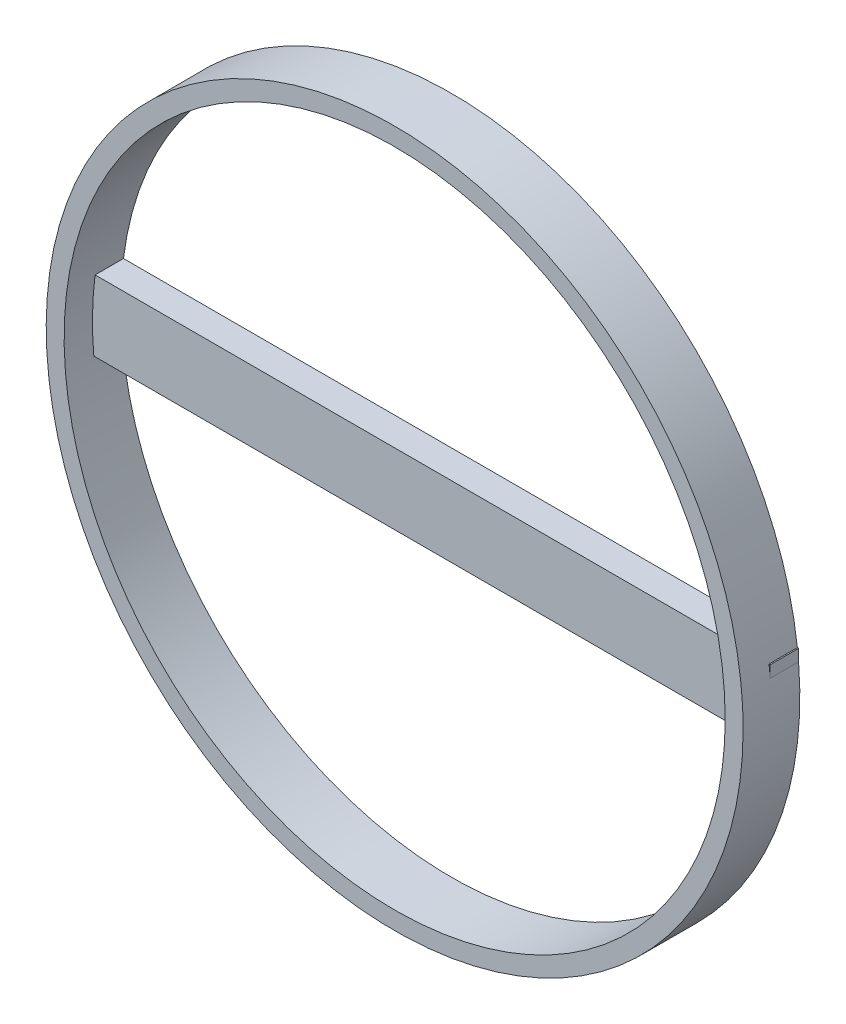
from build123d import *

# Parameters (mm, degrees)
SKETCH1_R           = 24.565
SKETCH1_R_2         = 23.302294554
BOSS_EXTRUDE1_DEPTH = 4
SKETCH2_W           = 48.867774731
SKETCH2_H           = 5
BOSS_EXTRUDE6_DEPTH = 2


with BuildPart() as part:
    # Sketch1 → Boss-Extrude1 (new body)
    with BuildSketch(Plane.XY):
        Circle(SKETCH1_R)
        Circle(SKETCH1_R_2, mode=Mode.SUBTRACT)
    extrude(amount=BOSS_EXTRUDE1_DEPTH)

    # Sketch2 → Boss-Extrude6 (add)
    with BuildSketch(Plane.XY):
        with Locations((0.042503616, 0.415411429)):
            Rectangle(SKETCH2_W, SKETCH2_H)
    extrude(amount=BOSS_EXTRUDE6_DEPTH)


solid = part.part
